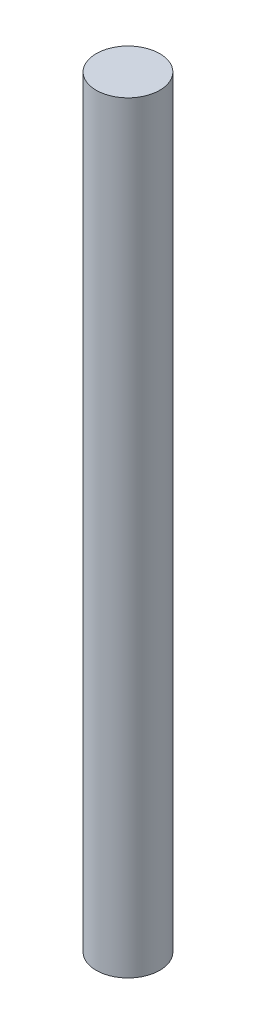
from build123d import *

# Parameters (mm, degrees)
SKETCH_1_R      = 1.5
EXTRUDE_1_DEPTH = 36


with BuildPart() as part:
    # 草图1 → 凸台-拉伸1 (new body)
    with BuildSketch(Plane(origin=(0, 0, 0), x_dir=(1, 0, 0), z_dir=(0, 1, 0))):
        with Locations(Location((0, 0, 0), (0, 0, 270))):
            Circle(SKETCH_1_R)
    extrude(amount=EXTRUDE_1_DEPTH)


solid = part.part
